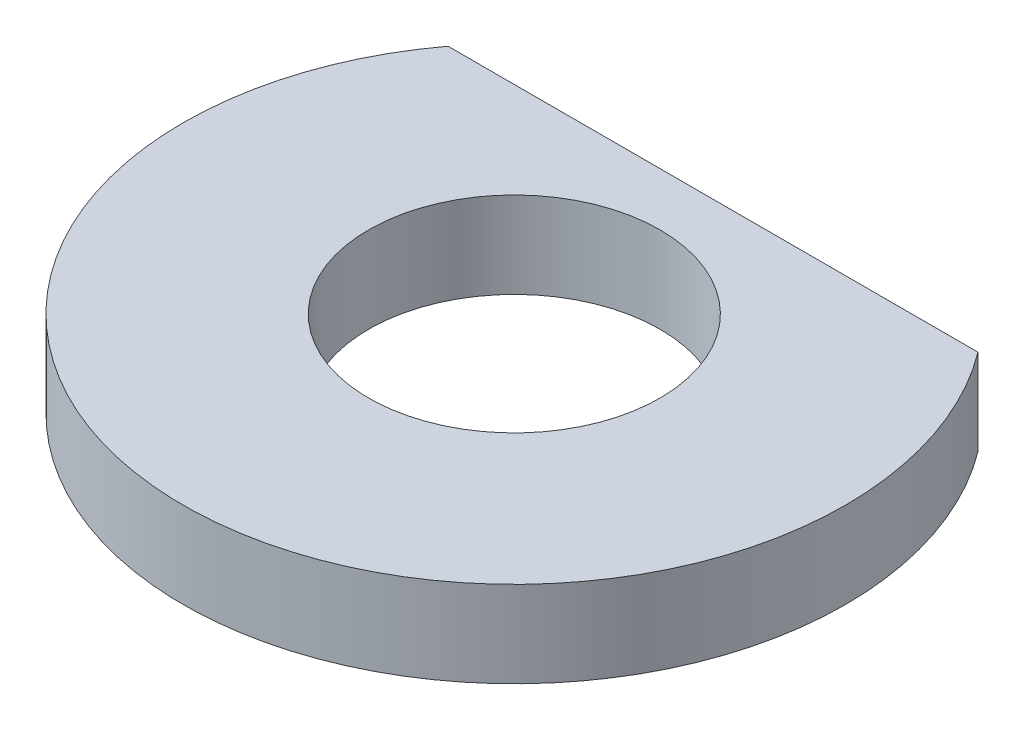
from build123d import *

# Parameters (mm, degrees)
SKETCH1_R               = 6.35
SKETCH1_R_2             = 2.794
BOSS_EXTRUDE1_DEPTH     = 1.651
CUT_EXTRUDE1_DEPTH      = 10.13076125
CUT_EXTRUDE1_DEPTH_BACK = 10.13076125


with BuildPart() as part:
    # Sketch1 → Boss-Extrude1 (new body)
    with BuildSketch(Plane(origin=(0, 0, 0), x_dir=(1, 0, 0), z_dir=(0, 1, 0))):
        with Locations(Location((0, 0, 0), (0, 0, 90))):
            Circle(SKETCH1_R)
        with Locations(Location((0, 0, 0), (0, 0, 90))):
            Circle(SKETCH1_R_2, mode=Mode.SUBTRACT)
    extrude(amount=BOSS_EXTRUDE1_DEPTH)

    # Sketch2 → Cut-Extrude1 (cut, two sides: drawn at the far end of the back side and taken through both)
    with BuildSketch(Plane(origin=(0, 1.651, 0), x_dir=(1, 0, 0), z_dir=(0, 1, 0)).offset(-CUT_EXTRUDE1_DEPTH_BACK)):
        Polygon((-45.66565023, 3.81), (-5.08, 3.81), (5.08, 3.81), (45.66565023, 3.81), (45.66565023, 84.98130046), (-45.66565023, 84.98130046), align=None)
    extrude(amount=CUT_EXTRUDE1_DEPTH + CUT_EXTRUDE1_DEPTH_BACK, mode=Mode.SUBTRACT)


solid = part.part
